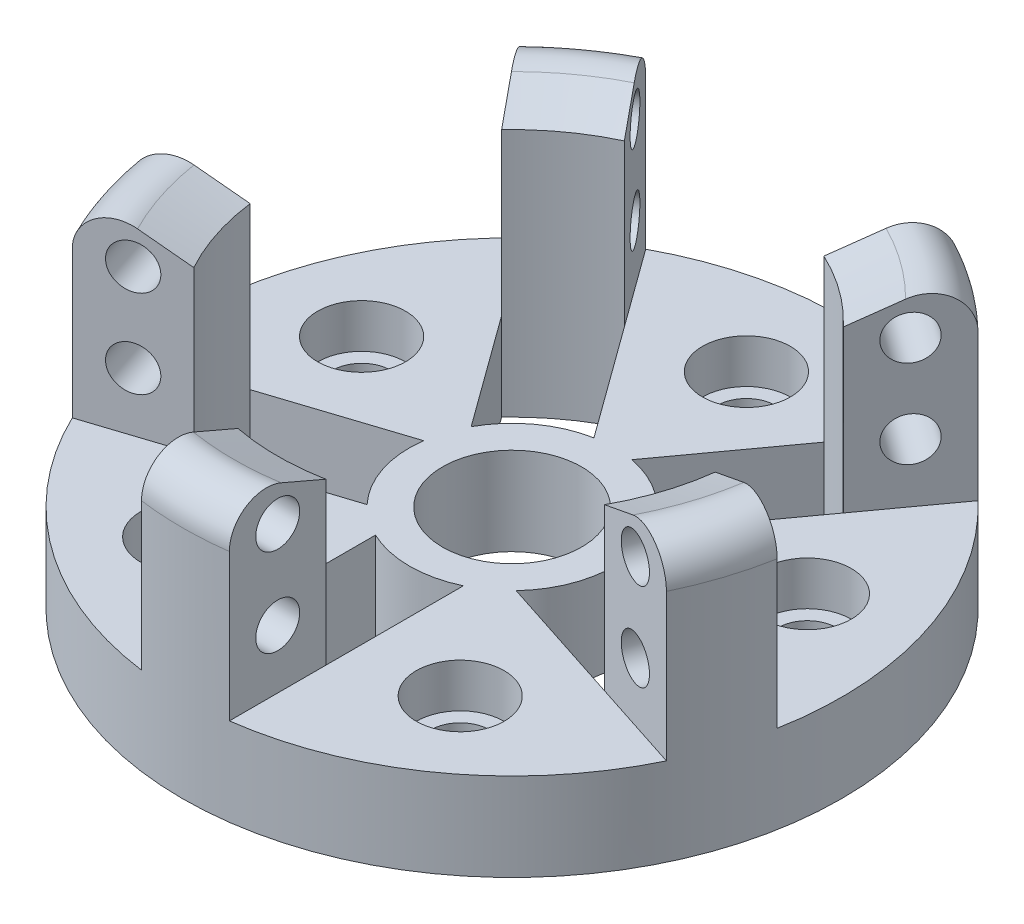
from build123d import *

# Parameters (mm, degrees)
CUT_EXTRUDE_2_DEPTH      = 69.387157144
SKETCH_3_R               = 6
SKETCH_3_R_2             = 4
CUT_EXTRUDE_3_DEPTH      = 6
SKETCH_7_R               = 4
CUT_EXTRUDE_5_DEPTH      = 69.387157144
PATTERN_CIRCULAR_2_COUNT = 5
SKETCH_8_R               = 9.5
CUT_EXTRUDE_6_DEPTH      = 69.387157144
CUT_EXTRUDE_7_DEPTH      = 69.387157144
PATTERN_CIRCULAR_4_COUNT = 5
SKETCH_10_R              = 3
CUT_EXTRUDE_10_DEPTH     = 79.346077675
PATTERN_CIRCULAR_5_COUNT = 5


with BuildPart() as part:
    # 草图1 → 旋转1 (revolve)
    with BuildSketch(Plane.XY, mode=Mode.PRIVATE) as revolve_1_sk:
        with BuildLine():
            Line((0, 0), (-45, 0))
            Line((-45, 0), (-45, 11.036038988))
            Line((-45, 11.036038988), (-45, 32.036038988))
            ThreePointArc((-45, 32.036038988), (-42.738612788, 36.219339121), (-38, 36.618614683))
            Line((-38, 36.618614683), (-32, 34))
            Line((-32, 34), (-32, 12))
            Line((-32, 12), (0, 12))
            Line((0, 12), (0, 0))
        make_face()
    revolve(revolve_1_sk.sketch.rotate(Axis((0, 12, 0), (0, -1, 0)), 270), axis=Axis((0, 12, 0), (0, -1, 0)))

    # 草图2 → 切除-拉伸2 (cut, through all)
    with BuildSketch(Plane(origin=(0, 12, 0), x_dir=(1, 0, 0), z_dir=(0, 1, 0))):
        with BuildLine():
            ThreePointArc((-23.329642683, 21.9026887), (-30.433808521, 9.88854382), (-31.748154807, -4.00682747))
            Line((-31.748154807, -4.00682747), (-13.884121066, 1.797548946))
            ThreePointArc((-13.884121066, 1.797548946), (-13.314791228, 4.326237921), (-12.289062655, 6.706633958))
            Line((-12.289062655, 6.706633958), (-23.329642683, 21.9026887))
        make_face()
        with BuildLine():
            ThreePointArc((13.621438751, 28.956111727), (0, 32), (-13.621438751, 28.956111727))
            Line((-13.621438751, 28.956111727), (-2.580858723, 13.760056986))
            ThreePointArc((-2.580858723, 13.760056986), (0, 14), (2.580858723, 13.760056986))
            Line((2.580858723, 13.760056986), (13.621438751, 28.956111727))
        make_face()
        with BuildLine():
            Line((13.884121066, 1.797548946), (31.748154807, -4.00682747))
            ThreePointArc((31.748154807, -4.00682747), (31.93697664, -2.007367205), (32, 0))
            ThreePointArc((32, 0), (29.753559164, 11.778188191), (23.329642683, 21.9026887))
            Line((23.329642683, 21.9026887), (12.289062655, 6.706633958))
            ThreePointArc((12.289062655, 6.706633958), (13.314791228, 4.326237921), (13.884121066, 1.797548946))
        make_face()
        with BuildLine():
            ThreePointArc((10.175917134, -9.615129249), (8.228993532, -11.326237921), (6, -12.649110641))
            Line((6, -12.649110641), (6, -31.432467291))
            ThreePointArc((6, -31.432467291), (18.809128073, -25.88854382), (28.039950874, -15.419505666))
            Line((28.039950874, -15.419505666), (10.175917134, -9.615129249))
        make_face()
        with BuildLine():
            ThreePointArc((-28.039950874, -15.419505666), (-18.809128073, -25.88854382), (-6, -31.432467291))
            Line((-6, -31.432467291), (-6, -12.649110641))
            ThreePointArc((-6, -12.649110641), (-8.228993532, -11.326237921), (-10.175917134, -9.615129249))
            Line((-10.175917134, -9.615129249), (-28.039950874, -15.419505666))
        make_face()
        with BuildLine():
            ThreePointArc((28.039950874, -15.419505666), (18.809128073, -25.88854382), (6, -31.432467291))
            Line((6, -31.432467291), (6, -44.598206242))
            ThreePointArc((6, -44.598206242), (26.450336353, -36.405764747), (40.561312695, -19.487942745))
            Line((40.561312695, -19.487942745), (28.039950874, -15.419505666))
        make_face()
        with BuildLine():
            ThreePointArc((32, 0), (31.93697664, -2.007367205), (31.748154807, -4.00682747))
            Line((31.748154807, -4.00682747), (44.269516628, -8.07526455))
            ThreePointArc((44.269516628, -8.07526455), (42.797543233, 13.905764747), (31.068269874, 32.553995255))
            Line((31.068269874, 32.553995255), (23.329642683, 21.9026887))
            ThreePointArc((23.329642683, 21.9026887), (29.753559164, 11.778188191), (32, 0))
        make_face()
        with BuildLine():
            Line((-21.360065941, 39.607418282), (-13.621438751, 28.956111727))
            ThreePointArc((-13.621438751, 28.956111727), (0, 32), (13.621438751, 28.956111727))
            Line((13.621438751, 28.956111727), (21.360065941, 39.607418282))
            ThreePointArc((21.360065941, 39.607418282), (0, 45), (-21.360065941, 39.607418282))
        make_face()
        with BuildLine():
            Line((-44.269516628, -8.07526455), (-31.748154807, -4.00682747))
            ThreePointArc((-31.748154807, -4.00682747), (-30.433808521, 9.88854382), (-23.329642683, 21.9026887))
            Line((-23.329642683, 21.9026887), (-31.068269874, 32.553995255))
            ThreePointArc((-31.068269874, 32.553995255), (-42.797543233, 13.905764747), (-44.269516628, -8.07526455))
        make_face()
        with BuildLine():
            Line((-6, -44.598206242), (-6, -31.432467291))
            ThreePointArc((-6, -31.432467291), (-18.809128073, -25.88854382), (-28.039950874, -15.419505666))
            Line((-28.039950874, -15.419505666), (-40.561312695, -19.487942745))
            ThreePointArc((-40.561312695, -19.487942745), (-26.450336353, -36.405764747), (-6, -44.598206242))
        make_face()
    extrude(amount=CUT_EXTRUDE_2_DEPTH, mode=Mode.SUBTRACT)

    # 草图3 → 切除-拉伸3 (cut)
    with BuildSketch(Plane(origin=(0, 12, 0), x_dir=(1, 0, 0), z_dir=(0, 1, 0))):
        with Locations(Location((0, 32, 0), (0, 0, 270))):
            Circle(SKETCH_3_R)
        with Locations(Location((0, 32, 0), (0, 0, 270))):
            Circle(SKETCH_3_R_2, mode=Mode.SUBTRACT)
    cut_extrude_3 = extrude(amount=-CUT_EXTRUDE_3_DEPTH, mode=Mode.SUBTRACT)

    # 草图7 → 切除-拉伸5 (cut, through all)
    with BuildSketch(Plane(origin=(0, 12, 0), x_dir=(1, 0, 0), z_dir=(0, 1, 0))):
        with Locations(Location((0, 32, 0), (0, 0, 270))):
            Circle(SKETCH_7_R)
    cut_extrude_5 = extrude(amount=-CUT_EXTRUDE_5_DEPTH, mode=Mode.SUBTRACT)

    # 阵列(圆周)2: 切除-拉伸3, 切除-拉伸5 ×5 about axis
    pattern_circular_2_axis = Axis((0, 0, 0), (0, 1, 0))
    add([cut_extrude_3.rotate(pattern_circular_2_axis, i * 360 / PATTERN_CIRCULAR_2_COUNT) for i in range(1, PATTERN_CIRCULAR_2_COUNT)], mode=Mode.SUBTRACT)
    add([cut_extrude_5.rotate(pattern_circular_2_axis, i * 360 / PATTERN_CIRCULAR_2_COUNT) for i in range(1, PATTERN_CIRCULAR_2_COUNT)], mode=Mode.SUBTRACT)

    # 草图8 → 切除-拉伸6 (cut, through all)
    with BuildSketch(Plane(origin=(0, 12, 0), x_dir=(1, 0, 0), z_dir=(0, 1, 0))):
        with Locations(Location((0, 0, 0), (0, 0, 270))):
            Circle(SKETCH_8_R)
    extrude(amount=-CUT_EXTRUDE_6_DEPTH, mode=Mode.SUBTRACT)

    # 草图9 → 切除-拉伸7 (cut, through all)
    with BuildSketch(Plane(origin=(0, 12, 0), x_dir=(1, 0, 0), z_dir=(0, 1, 0))):
        with BuildLine():
            Line((-6, -12.649110641), (-6, -31.432467291))
            ThreePointArc((-6, -31.432467291), (0, -32), (6, -31.432467291))
            Line((6, -31.432467291), (6, -12.649110641))
            ThreePointArc((6, -12.649110641), (0, -14), (-6, -12.649110641))
        make_face()
    cut_extrude_7 = extrude(amount=-CUT_EXTRUDE_7_DEPTH, mode=Mode.SUBTRACT)

    # 阵列(圆周)4: 切除-拉伸7 ×5 about axis
    pattern_circular_4_axis = Axis((0, 0, 0), (0, 1, 0))
    for i in range(1, PATTERN_CIRCULAR_4_COUNT):
        add(cut_extrude_7.rotate(pattern_circular_4_axis, i * 360 / PATTERN_CIRCULAR_4_COUNT), mode=Mode.SUBTRACT)

    # 草图10 → 切除-拉伸10 (cut, through all)
    with BuildSketch(Plane(origin=(1.854101966, 0, 5.706339098), x_dir=(0.9510565162951544, 0, -0.30901699437494484), z_dir=(0.30901699437494484, 0, 0.9510565162951544))):
        with Locations((-38, 32)):
            Circle(SKETCH_10_R)
        with Locations((-38, 20)):
            Circle(SKETCH_10_R)
    cut_extrude_10 = extrude(amount=-CUT_EXTRUDE_10_DEPTH, mode=Mode.SUBTRACT)

    # 阵列(圆周)5: 切除-拉伸10 ×5 about axis
    pattern_circular_5_axis = Axis((0, 12, 0), (0, 1, 0))
    for i in range(1, PATTERN_CIRCULAR_5_COUNT):
        add(cut_extrude_10.rotate(pattern_circular_5_axis, i * 360 / PATTERN_CIRCULAR_5_COUNT), mode=Mode.SUBTRACT)


solid = part.part
